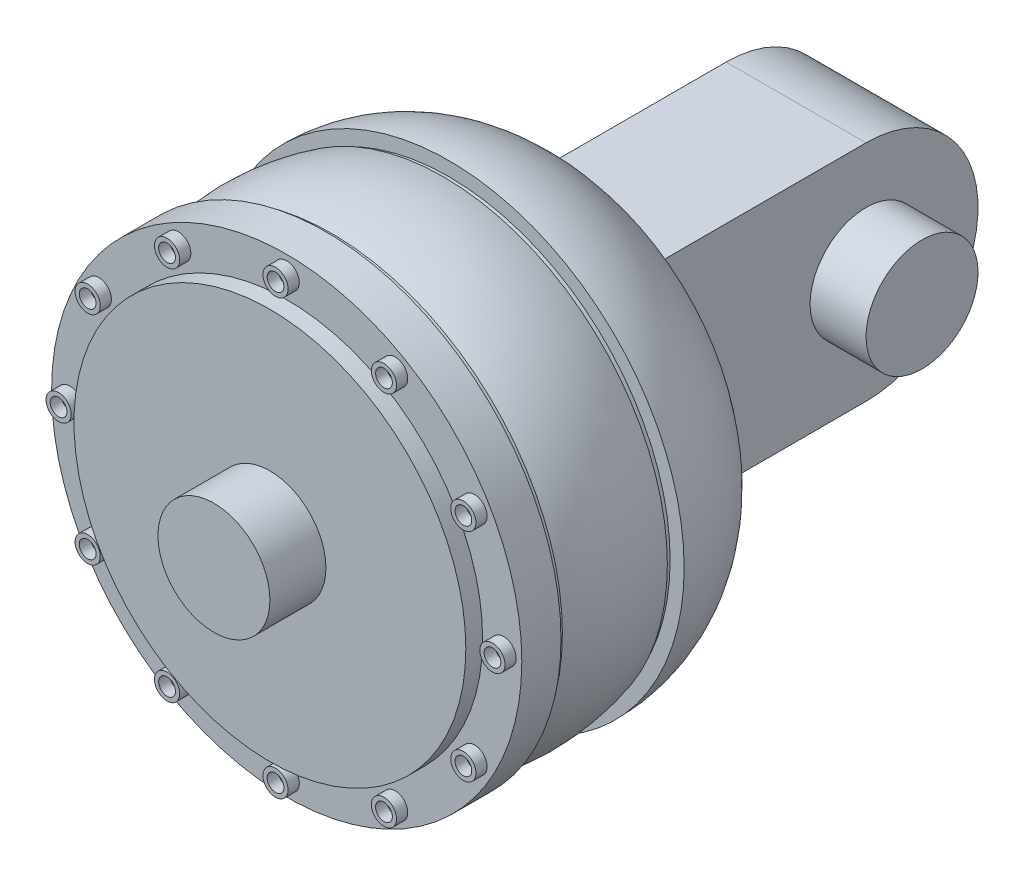
from build123d import *

# Parameters (mm, degrees)
SKETCH2_R           = 39.5
BOSS_EXTRUDE1_DEPTH = 1
SKETCH4_R           = 41.25
BOSS_EXTRUDE2_DEPTH = 1
SKETCH5_R           = 42
BOSS_EXTRUDE3_DEPTH = 7
SKETCH6_R           = 35
BOSS_EXTRUDE4_DEPTH = 3
SKETCH7_R           = 2.25
SKETCH7_R_2         = 1.5
BOSS_EXTRUDE5_DEPTH = 2
CIRPATTERN1_COUNT   = 12
SKETCH8_W           = 25
SKETCH8_H           = 40
BOSS_EXTRUDE6_DEPTH = 42
SKETCH9_R           = 20
BOSS_EXTRUDE7_DEPTH = 25
SKETCH10_R          = 10
BOSS_EXTRUDE8_DEPTH = 10
SKETCH11_R          = 10
BOSS_EXTRUDE9_DEPTH = 10


with BuildPart() as part:
    # Sketch1 → Revolve1 (revolve)
    with BuildSketch(Plane(origin=(0, 0, 0), x_dir=(1, 0, 0), z_dir=(0, 1, 0)), mode=Mode.PRIVATE) as revolve1_sk:
        with BuildLine():
            Line((-42, 0), (0, 0))
            Line((0, 0), (0, 20))
            Line((0, 20), (-32, 20))
            ThreePointArc((-32, 20), (-39.360679775, 11.180339887), (-42, 0))
        make_face()
    revolve(revolve1_sk.sketch.rotate(Axis((0, 0, 0), (0, 0, -1)), 180), axis=Axis((0, 0, 0), (0, 0, -1)))

    # Sketch2 → Boss-Extrude1 (add)
    with BuildSketch(Plane.XY):
        Circle(SKETCH2_R)
    extrude(amount=BOSS_EXTRUDE1_DEPTH)

    # Sketch3 → Revolve2 (revolve)
    with BuildSketch(Plane(origin=(0, 0, 0), x_dir=(1, 0, 0), z_dir=(0, 1, 0)), mode=Mode.PRIVATE) as revolve2_sk:
        with BuildLine():
            Line((0, -1), (0, -21))
            Line((0, -21), (-40, -21))
            ThreePointArc((-40, -21), (-41.376973739, -11), (-40, -1))
            Line((-40, -1), (0, -1))
        make_face()
    revolve(revolve2_sk.sketch.rotate(Axis((0, 0, 1), (0, 0, 1)), 180), axis=Axis((0, 0, 1), (0, 0, 1)))

    # Sketch4 → Boss-Extrude2 (add)
    with BuildSketch(Plane.XY.offset(21)):
        Circle(SKETCH4_R)
    extrude(amount=BOSS_EXTRUDE2_DEPTH)

    # Sketch5 → Boss-Extrude3 (add)
    with BuildSketch(Plane.XY.offset(22)):
        Circle(SKETCH5_R)
    extrude(amount=BOSS_EXTRUDE3_DEPTH)

    # Sketch6 → Boss-Extrude4 (add)
    with BuildSketch(Plane.XY.offset(29)):
        Circle(SKETCH6_R)
    extrude(amount=BOSS_EXTRUDE4_DEPTH)

    # Sketch7 → Boss-Extrude5 (add)
    with BuildSketch(Plane.XY.offset(29)):
        with Locations((38.75, 0)):
            Circle(SKETCH7_R)
        with Locations((38.75, 0)):
            Circle(SKETCH7_R_2, mode=Mode.SUBTRACT)
    boss_extrude5 = extrude(amount=BOSS_EXTRUDE5_DEPTH)

    # CirPattern1: Boss-Extrude5 ×12 about axis
    cirpattern1_axis = Axis((0, 0, 0), (0, 0, 1))
    for i in range(1, CIRPATTERN1_COUNT):
        add(boss_extrude5.rotate(cirpattern1_axis, i * 360 / CIRPATTERN1_COUNT))

    # Sketch8 → Boss-Extrude6 (add)
    with BuildSketch(Plane(origin=(0, 0, -20), x_dir=(-1, 0, 0), z_dir=(0, 0, -1))):
        Rectangle(SKETCH8_W, SKETCH8_H)
    extrude(amount=BOSS_EXTRUDE6_DEPTH)

    # Sketch9 → Boss-Extrude7 (add)
    with BuildSketch(Plane.ZY.offset(12.5)):
        with Locations((-62, 0)):
            Circle(SKETCH9_R)
    extrude(amount=-BOSS_EXTRUDE7_DEPTH)

    # Sketch10 → Boss-Extrude8 (add)
    with BuildSketch(Plane.ZY.offset(12.5)):
        with Locations(Location((-62, 0, 0), (0, 0, 90))):
            Circle(SKETCH10_R)
    boss_extrude8 = extrude(amount=BOSS_EXTRUDE8_DEPTH)

    # Mirror1: Boss-Extrude8 across plane
    add(boss_extrude8.mirror(Plane(origin=(0, 0, 0), x_dir=(0, 0, 1), z_dir=(1, 0, 0))))

    # Sketch11 → Boss-Extrude9 (add)
    with BuildSketch(Plane.XY.offset(32)):
        Circle(SKETCH11_R)
    extrude(amount=BOSS_EXTRUDE9_DEPTH)


solid = part.part
